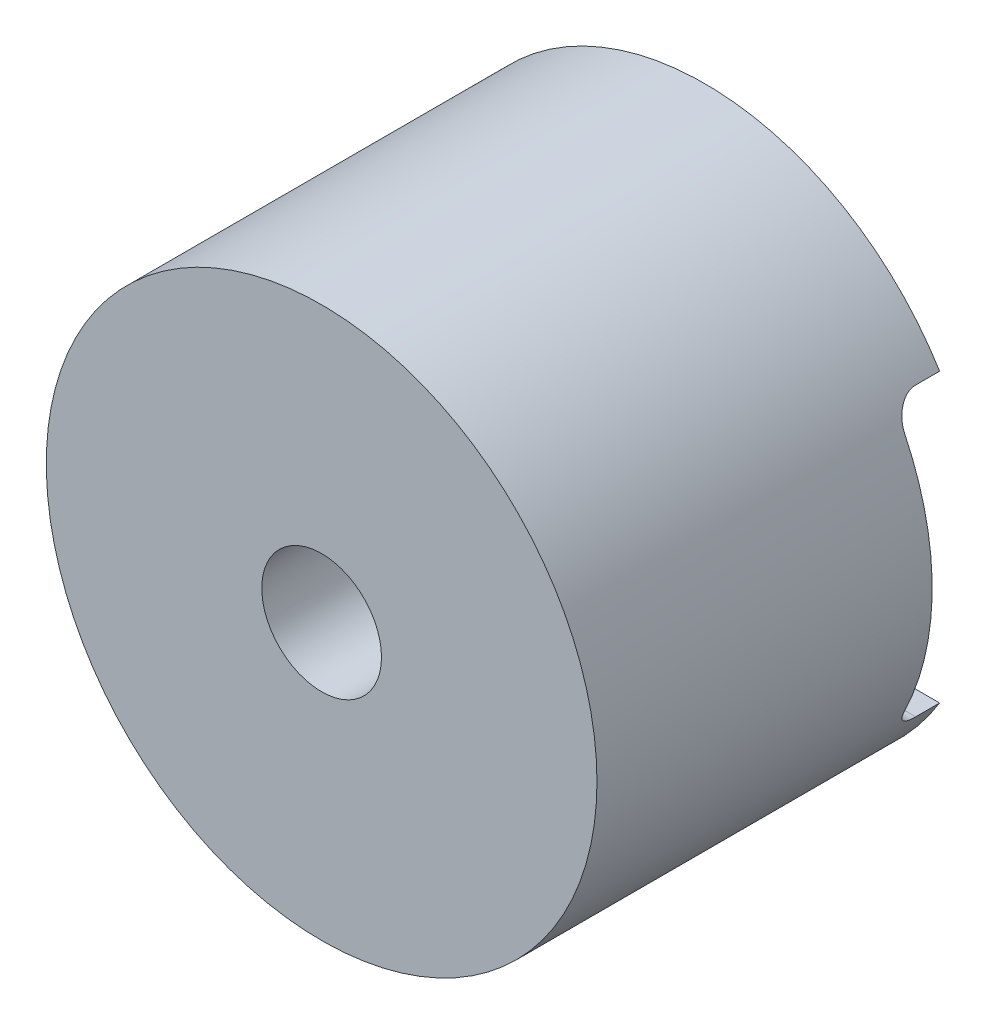
from build123d import *

# Parameters (mm, degrees)
SKIZZE1_R                       = 5.75
AUFSATZ_LINEAR_AUSTRAGEN1_DEPTH = 8
SKIZZE2_R                       = 4.5
SCHNITT_LINEAR_AUSTRAGEN1_DEPTH = 1
SKIZZE3_W                       = 13.35916622
SKIZZE3_H                       = 6
SCHNITT_LINEAR_AUSTRAGEN2_DEPTH = 1
VERRUNDUNG1_R                   = 0.5
SKIZZE4_R                       = 1.25
SCHNITT_LINEAR_AUSTRAGEN3_DEPTH = 3
SKIZZE5_R                       = 4.5
SCHNITT_LINEAR_AUSTRAGEN4_DEPTH = 1


with BuildPart() as part:
    # Skizze1 → Aufsatz-Linear austragen1 (new body)
    with BuildSketch(Plane(origin=(0, 0, 0), x_dir=(0, 1, 0), z_dir=(0, 0, 1))):
        with Locations(Location((0, 0, 0), (0, 0, 270))):
            Circle(SKIZZE1_R)
    extrude(amount=AUFSATZ_LINEAR_AUSTRAGEN1_DEPTH)

    # Skizze2 → Schnitt-Linear austragen1 (cut)
    with BuildSketch(Plane(origin=(0, 0, 0), x_dir=(1, 0, 0), z_dir=(0, 0, -1))):
        with Locations(Location((0, 0, 0), (0, 0, 180))):
            Circle(SKIZZE2_R)
    extrude(amount=-SCHNITT_LINEAR_AUSTRAGEN1_DEPTH, mode=Mode.SUBTRACT)

    # Skizze3 → Schnitt-Linear austragen2 (cut)
    with BuildSketch(Plane(origin=(0, 0, 0), x_dir=(1, 0, 0), z_dir=(0, 0, -1))):
        Rectangle(SKIZZE3_W, SKIZZE3_H)
    extrude(amount=-SCHNITT_LINEAR_AUSTRAGEN2_DEPTH, mode=Mode.SUBTRACT)

    # Verrundung1
    verrundung1_edges = [part.edges().sort_by_distance(p)[0] for p in [
        (4.129728092, 3, 1),
        (-4.129728092, 3, 1),
        (-4.129728092, -3, 1),
        (4.129728092, -3, 1),
    ]]
    fillet(verrundung1_edges, radius=VERRUNDUNG1_R)

    # Skizze4 → Schnitt-Linear austragen3 (cut)
    with BuildSketch(Plane.XY.offset(8)):
        Circle(SKIZZE4_R)
    extrude(amount=-SCHNITT_LINEAR_AUSTRAGEN3_DEPTH, mode=Mode.SUBTRACT)

    # Skizze5 → Schnitt-Linear austragen4 (cut)
    with BuildSketch(Plane(origin=(0, 0, 1), x_dir=(1, 0, 0), z_dir=(0, 0, -1))):
        with Locations(Location((0, 0, 0), (0, 0, 180))):
            Circle(SKIZZE5_R)
    extrude(amount=-SCHNITT_LINEAR_AUSTRAGEN4_DEPTH, mode=Mode.SUBTRACT)


solid = part.part
